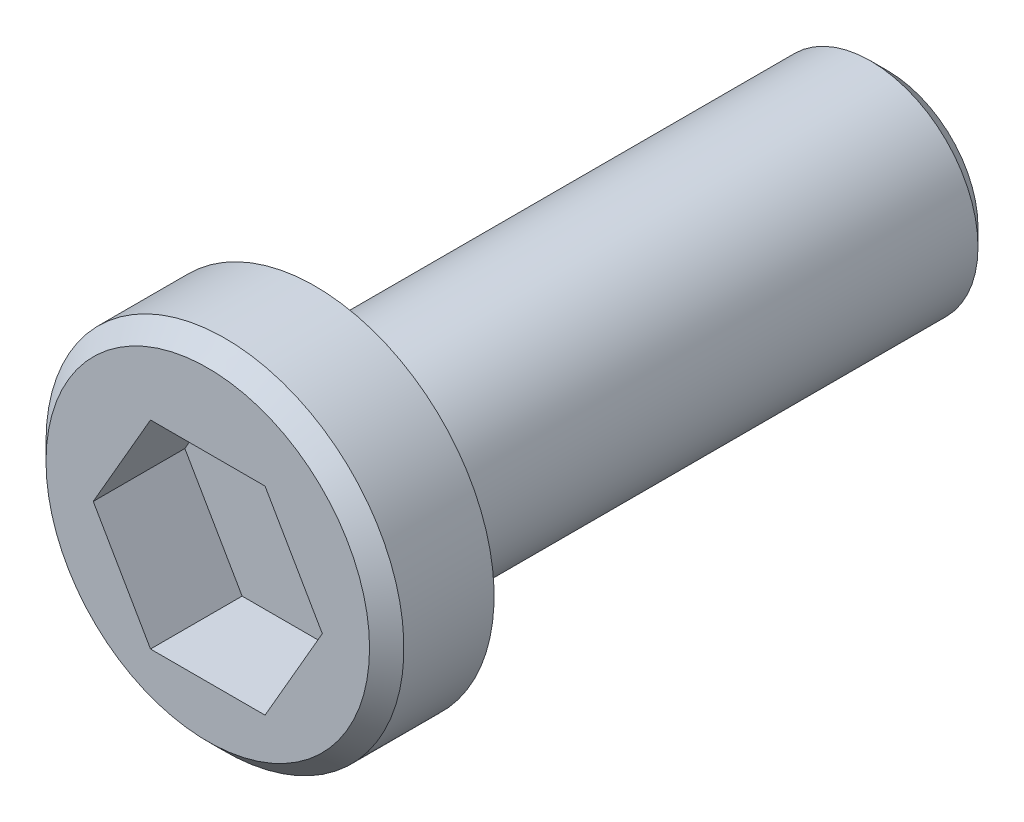
from build123d import *

# Parameters (mm, degrees)
SKETCH1_R          = 4.7625
EXTRUDE1_DEPTH     = 25.4
SKETCH3_R          = 7.9375
EXTRUDE3_DEPTH     = 4.7625
CHAMFER1_SIZE      = 0.762
CUT_EXTRUDE1_DEPTH = 4.064


with BuildPart() as part:
    # Sketch1 → Extrude1 (new body)
    with BuildSketch(Plane.XY):
        Circle(SKETCH1_R)
    extrude(amount=EXTRUDE1_DEPTH)

    # Sketch3 → Extrude3 (add)
    with BuildSketch(Plane.XY.offset(25.4)):
        with Locations(Location((0, 0.491553118, 0), (0, 0, 180))):
            Circle(SKETCH3_R)
    extrude(amount=EXTRUDE3_DEPTH)

    # Chamfer1
    chamfer1_edges = [part.edges().sort_by_distance(p)[0] for p in [
        (-4.7625, 0, 0),
        (7.9375, 0.491553118, 30.1625),
    ]]
    chamfer(chamfer1_edges, length=CHAMFER1_SIZE)

    # Sketch4 → Cut-Extrude1 (cut)
    with BuildSketch(Plane.XY.offset(30.1625)):
        Polygon((5.08, 0), (2.54, 4.399409051), (-2.54, 4.399409051), (-5.08, 0), (-2.54, -4.399409051), (2.54, -4.399409051), align=None)
    extrude(amount=-CUT_EXTRUDE1_DEPTH, mode=Mode.SUBTRACT)


solid = part.part
